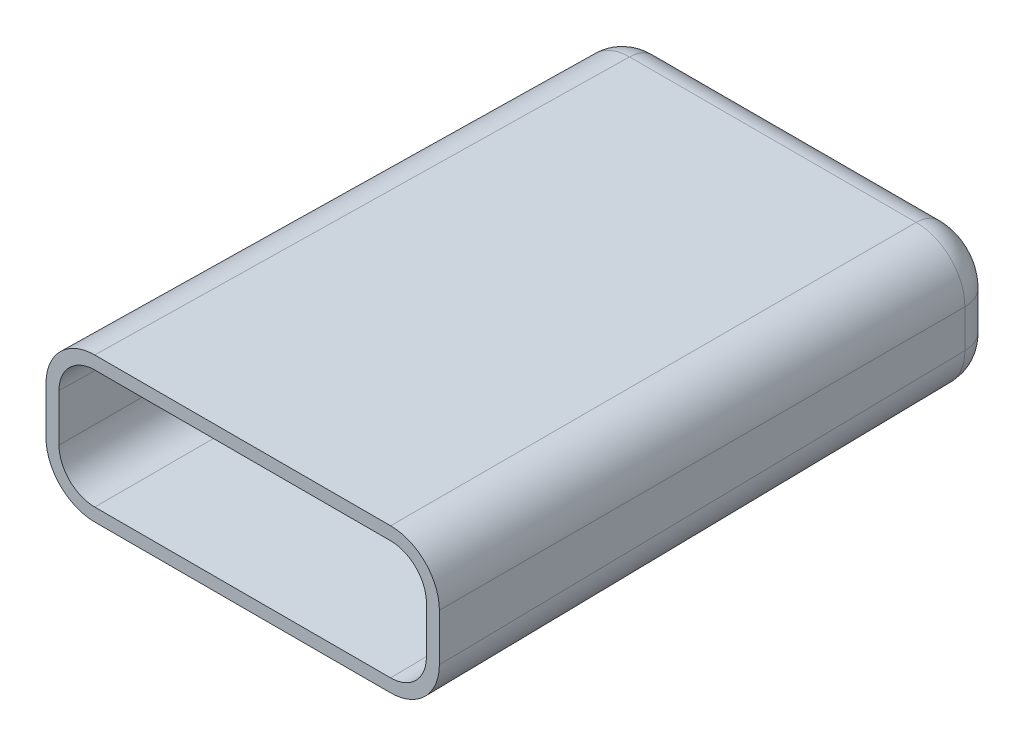
from build123d import *
from OCP.BRepFilletAPI import BRepFilletAPI_MakeFillet

# Parameters (mm, degrees)
SKETCH2_W           = 23.6
SKETCH2_H           = 8.3
BOSS_EXTRUDE1_DEPTH = 34.6
BOSS_EXTRUDE1_DRAFT = -0.5
FILLET1_R1          = 2
FILLET1_R2          = 3
SHELL1_T            = -0.8
CUT_EXTRUDE1_DEPTH  = 33.85


with BuildPart() as part:
    # Sketch2 → Boss-Extrude1 (with draft: the straight prism first)
    with BuildSketch(Plane.XY):
        Rectangle(SKETCH2_W, SKETCH2_H)
    extrude(amount=BOSS_EXTRUDE1_DEPTH)
    # Boss-Extrude1: the draft: its side faces are tilted about the plane it starts from
    boss_extrude1_sides = [part.faces().sort_by_distance(p)[0] for p in [
        (0, -4.15, 17.3),
        (11.8, 0, 17.3),
        (0, 4.15, 17.3),
        (-11.8, 0, 17.3),
    ]]
    draft(boss_extrude1_sides, Plane.XY, BOSS_EXTRUDE1_DRAFT)

    # Fillet1: one fillet with a radius per group of edges: ONE call of the kernel's fillet builder (fillet() takes one radius for all edges)
    fillet1_edges_1 = [part.edges().sort_by_distance(p)[0] for p in [
        (0, -4.15, 0),
        (-11.8, 0, 0),
        (0, 4.15, 0),
        (11.8, 0, 0),
    ]]
    fillet1_edges_2 = [part.edges().sort_by_distance(p)[0] for p in [
        (11.950974813, -4.300974813, 17.3),
        (-11.950974813, -4.300974813, 17.3),
        (-11.950974813, 4.300974813, 17.3),
        (11.950974813, 4.300974813, 17.3),
    ]]
    fillet1 = BRepFilletAPI_MakeFillet(part.part.solid().wrapped)
    for e in fillet1_edges_1:
        fillet1.Add(FILLET1_R1, e.wrapped)
    for e in fillet1_edges_2:
        fillet1.Add(FILLET1_R2, e.wrapped)
    add(Compound.cast(fillet1.Shape()), mode=Mode.REPLACE)

    # Shell1
    shell1_openings = [part.faces().sort_by_distance(p)[0] for p in [
        (0, 0, 34.6),
    ]]
    offset(amount=SHELL1_T, openings=shell1_openings, kind=Kind.INTERSECTION)

    # Sketch3 → Cut-Extrude1 (cut)
    with BuildSketch(Plane(origin=(0, 0, 0), x_dir=(-1, 0, 0), z_dir=(0, 0, -1))):
        with BuildLine():
            Line((3.01539715, 2.217301425), (-3.05, 2.217301425))
            ThreePointArc((-3.05, 2.217301425), (-3.626903312, 1.989192787), (-3.867301425, 1.417301425))
            Line((-3.867301425, 1.417301425), (-3.867301425, 0.541731715))
            ThreePointArc((-3.867301425, 0.541731715), (-3.820065179, 0.308381695), (-3.685793986, 0.111773604))
            Line((-3.685793986, 0.111773604), (-2.807954647, -0.742656685))
            ThreePointArc((-2.807954647, -0.742656685), (-2.615321704, -0.868564956), (-2.389462086, -0.912698575))
            Line((-2.389462086, -0.912698575), (2.354859236, -0.912698575))
            ThreePointArc((2.354859236, -0.912698575), (2.580718854, -0.868564956), (2.773351797, -0.742656685))
            Line((2.773351797, -0.742656685), (3.651191136, 0.111773604))
            ThreePointArc((3.651191136, 0.111773604), (3.776159697, 0.310381805), (3.81539715, 0.541731715))
            Line((3.81539715, 0.541731715), (3.81539715, 1.417301425))
            ThreePointArc((3.81539715, 1.417301425), (3.581082575, 1.98298685), (3.01539715, 2.217301425))
        make_face()
    extrude(amount=-CUT_EXTRUDE1_DEPTH, mode=Mode.SUBTRACT)


solid = part.part
